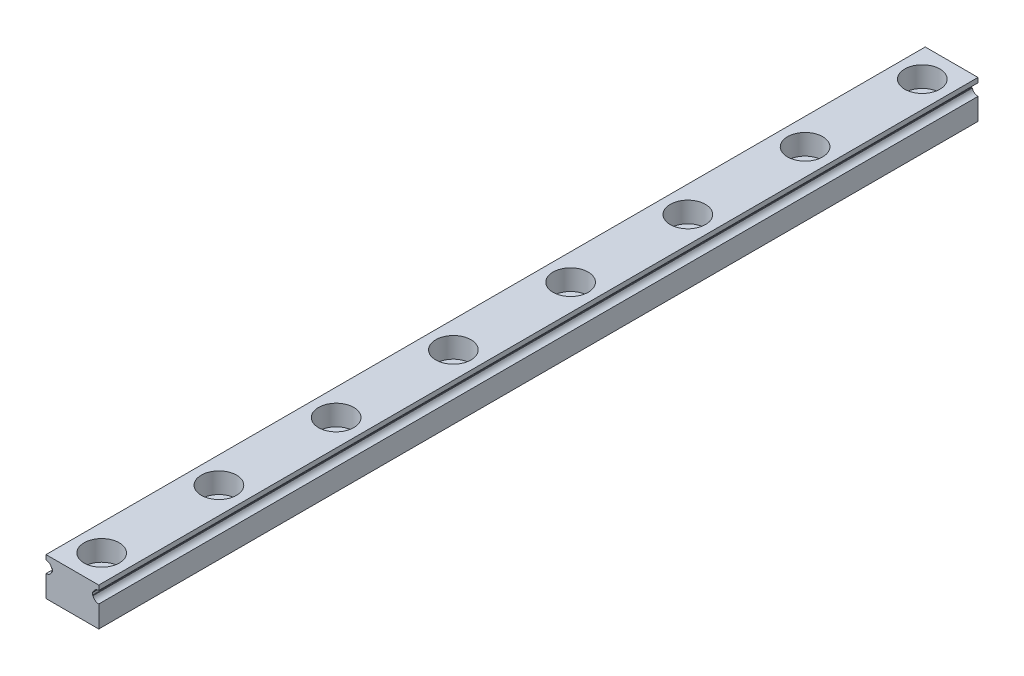
from build123d import *

# Parameters (mm, degrees)
EXTRUDE1_DEPTH  = 150
SKETCH2_R       = 3
EXTRUDE2_DEPTH  = 3.5
SKETCH_R        = 1.75
EXTRUDE3_DEPTH  = 151.208188858
LPATTERN1_COUNT = 40
LPATTERN1_PITCH = 20


with BuildPart() as part:
    # Sketch1 → Extrude1 (new body)
    with BuildSketch(Plane.XY):
        with BuildLine():
            Line((-4.5, -3.25), (4.5, -3.25))
            Line((4.5, -3.25), (4.5, 0.45))
            ThreePointArc((4.5, 0.45), (3.887627564, 0.659430585), (3.531754163, 1.2))
            Line((3.531754163, 1.2), (3.4, 1.2))
            Line((3.4, 1.2), (3.4, 1.7))
            Line((3.4, 1.7), (3.531754163, 1.7))
            ThreePointArc((3.531754163, 1.7), (3.887627564, 2.240569415), (4.5, 2.45))
            Line((4.5, 2.45), (4.5, 3.25))
            Line((4.5, 3.25), (-4.5, 3.25))
            Line((-4.5, 3.25), (-4.5, 2.45))
            ThreePointArc((-4.5, 2.45), (-3.887627564, 2.240569415), (-3.531754163, 1.7))
            Line((-3.531754163, 1.7), (-3.4, 1.7))
            Line((-3.4, 1.7), (-3.4, 1.2))
            Line((-3.4, 1.2), (-3.531754163, 1.2))
            ThreePointArc((-3.531754163, 1.2), (-3.887627564, 0.659430585), (-4.5, 0.45))
            Line((-4.5, 0.45), (-4.5, -3.25))
        make_face()
    extrude(amount=EXTRUDE1_DEPTH)

    # Sketch2 → Extrude2 (cut)
    with BuildSketch(Plane(origin=(0, 3.25, 0), x_dir=(1, 0, 0), z_dir=(0, 1, 0))):
        with Locations(Location((0, -5, 0), (0, 0, 270))):
            Circle(SKETCH2_R)
    extrude2 = extrude(amount=-EXTRUDE2_DEPTH, mode=Mode.SUBTRACT)

    # Sketch → Extrude3 (cut, through all)
    with BuildSketch(Plane(origin=(0, 3.25, 0), x_dir=(1, 0, 0), z_dir=(0, 1, 0))):
        with Locations(Location((0, -5, 0), (0, 0, 270))):
            Circle(SKETCH_R)
    extrude3 = extrude(amount=-EXTRUDE3_DEPTH, mode=Mode.SUBTRACT)

    # LPattern1: Extrude2, Extrude3 ×40
    with Locations(*[(0, 0, i * LPATTERN1_PITCH) for i in range(1, LPATTERN1_COUNT)]):
        add(extrude2, mode=Mode.SUBTRACT)
        add(extrude3, mode=Mode.SUBTRACT)


solid = part.part
